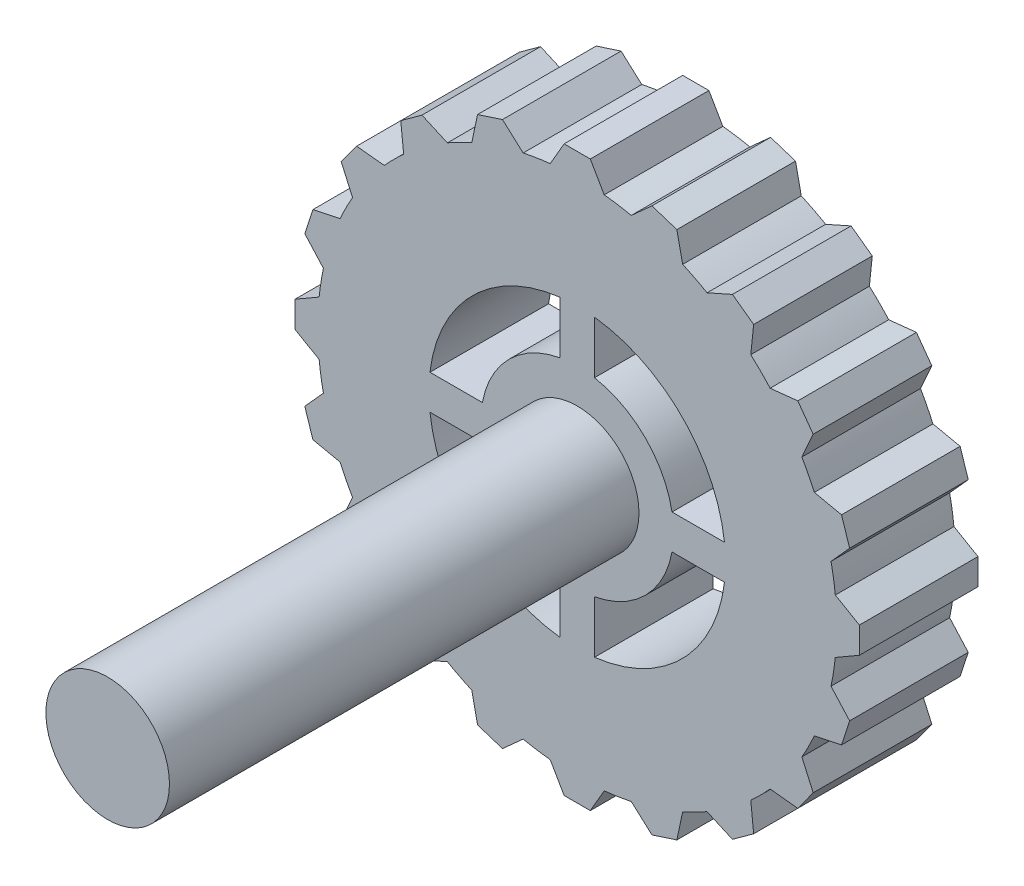
from build123d import *

# Parameters (mm, degrees)
DODANIE_WYCI_GNI_CIE2_DEPTH = 2.4
SZKIC2_R                    = 1.25
DODANIE_WYCI_GNI_CIE3_DEPTH = 2
DODANIE_WYCI_GNI_CIE4_START = 9.5
SZKIC3_R                    = 1.25
DODANIE_WYCI_GNI_CIE4_DEPTH = 9.5
WYTNIJ_WYCI_GNI_CIE1_DEPTH  = 9.5


with BuildPart() as part:
    # Szkic1 → Dodanie-wyciągnięcie2 (new body)
    with BuildSketch(Plane.XY):
        with BuildLine():
            Line((2.133245608, 4.797057762), (2.016205978, 5.347685932))
            Line((2.016205978, 5.347685932), (1.512146024, 5.511464939))
            Line((1.512146024, 5.511464939), (1.093807857, 5.134791561))
            ThreePointArc((1.093807857, 5.134791561), (0.821280941, 5.185363788), (0.546464765, 5.22148219))
            Line((0.546464765, 5.22148219), (0.265, 5.708993464))
            Line((0.265, 5.708993464), (-0.265, 5.708993464))
            Line((-0.265, 5.708993464), (-0.546464765, 5.22148219))
            ThreePointArc((-0.546464765, 5.22148219), (-0.821280941, 5.185363788), (-1.093807857, 5.134791561))
            Line((-1.093807857, 5.134791561), (-1.512146024, 5.511464939))
            Line((-1.512146024, 5.511464939), (-2.016205978, 5.347685932))
            Line((-2.016205978, 5.347685932), (-2.133245608, 4.797057762))
            ThreePointArc((-2.133245608, 4.797057762), (-2.383450124, 4.677784252), (-2.627010944, 4.545471757))
            Line((-2.627010944, 4.545471757), (-3.14127266, 4.774435825))
            Line((-3.14127266, 4.774435825), (-3.570051667, 4.462909641))
            Line((-3.570051667, 4.462909641), (-3.511209508, 3.903063898))
            ThreePointArc((-3.511209508, 3.903063898), (-3.712310601, 3.712310601), (-3.903063898, 3.511209508))
            Line((-3.903063898, 3.511209508), (-4.462909641, 3.570051667))
            Line((-4.462909641, 3.570051667), (-4.774435825, 3.14127266))
            Line((-4.774435825, 3.14127266), (-4.545471757, 2.627010944))
            ThreePointArc((-4.545471757, 2.627010944), (-4.677784252, 2.383450124), (-4.797057762, 2.133245608))
            Line((-4.797057762, 2.133245608), (-5.347685932, 2.016205978))
            Line((-5.347685932, 2.016205978), (-5.511464939, 1.512146024))
            Line((-5.511464939, 1.512146024), (-5.134791561, 1.093807857))
            ThreePointArc((-5.134791561, 1.093807857), (-5.185363788, 0.821280941), (-5.22148219, 0.546464765))
            Line((-5.22148219, 0.546464765), (-5.708993464, 0.265))
            Line((-5.708993464, 0.265), (-5.708993464, -0.265))
            Line((-5.708993464, -0.265), (-5.22148219, -0.546464765))
            ThreePointArc((-5.22148219, -0.546464765), (-5.185363788, -0.821280941), (-5.134791561, -1.093807857))
            Line((-5.134791561, -1.093807857), (-5.511464939, -1.512146024))
            Line((-5.511464939, -1.512146024), (-5.347685932, -2.016205978))
            Line((-5.347685932, -2.016205978), (-4.797057762, -2.133245608))
            ThreePointArc((-4.797057762, -2.133245608), (-4.677784252, -2.383450124), (-4.545471757, -2.627010944))
            Line((-4.545471757, -2.627010944), (-4.774435825, -3.14127266))
            Line((-4.774435825, -3.14127266), (-4.462909641, -3.570051667))
            Line((-4.462909641, -3.570051667), (-3.903063898, -3.511209508))
            ThreePointArc((-3.903063898, -3.511209508), (-3.712310601, -3.712310601), (-3.511209508, -3.903063898))
            Line((-3.511209508, -3.903063898), (-3.570051667, -4.462909641))
            Line((-3.570051667, -4.462909641), (-3.14127266, -4.774435825))
            Line((-3.14127266, -4.774435825), (-2.627010944, -4.545471757))
            ThreePointArc((-2.627010944, -4.545471757), (-2.383450124, -4.677784252), (-2.133245608, -4.797057762))
            Line((-2.133245608, -4.797057762), (-2.016205978, -5.347685932))
            Line((-2.016205978, -5.347685932), (-1.512146024, -5.511464939))
            Line((-1.512146024, -5.511464939), (-1.093807857, -5.134791561))
            ThreePointArc((-1.093807857, -5.134791561), (-0.821280941, -5.185363788), (-0.546464765, -5.22148219))
            Line((-0.546464765, -5.22148219), (-0.265, -5.708993464))
            Line((-0.265, -5.708993464), (0.265, -5.708993464))
            Line((0.265, -5.708993464), (0.546464765, -5.22148219))
            ThreePointArc((0.546464765, -5.22148219), (0.821280941, -5.185363788), (1.093807857, -5.134791561))
            Line((1.093807857, -5.134791561), (1.512146024, -5.511464939))
            Line((1.512146024, -5.511464939), (2.016205978, -5.347685932))
            Line((2.016205978, -5.347685932), (2.133245608, -4.797057762))
            ThreePointArc((2.133245608, -4.797057762), (2.383450124, -4.677784252), (2.627010944, -4.545471757))
            Line((2.627010944, -4.545471757), (3.14127266, -4.774435825))
            Line((3.14127266, -4.774435825), (3.570051667, -4.462909641))
            Line((3.570051667, -4.462909641), (3.511209508, -3.903063898))
            ThreePointArc((3.511209508, -3.903063898), (3.712310601, -3.712310601), (3.903063898, -3.511209508))
            Line((3.903063898, -3.511209508), (4.462909641, -3.570051667))
            Line((4.462909641, -3.570051667), (4.774435825, -3.14127266))
            Line((4.774435825, -3.14127266), (4.545471757, -2.627010944))
            ThreePointArc((4.545471757, -2.627010944), (4.677784252, -2.383450124), (4.797057762, -2.133245608))
            Line((4.797057762, -2.133245608), (5.347685932, -2.016205978))
            Line((5.347685932, -2.016205978), (5.511464939, -1.512146024))
            Line((5.511464939, -1.512146024), (5.134791561, -1.093807857))
            ThreePointArc((5.134791561, -1.093807857), (5.185363788, -0.821280941), (5.22148219, -0.546464765))
            Line((5.22148219, -0.546464765), (5.708993464, -0.265))
            Line((5.708993464, -0.265), (5.708993464, 0.265))
            Line((5.708993464, 0.265), (5.22148219, 0.546464765))
            ThreePointArc((5.22148219, 0.546464765), (5.185363788, 0.821280941), (5.134791561, 1.093807857))
            Line((5.134791561, 1.093807857), (5.511464939, 1.512146024))
            Line((5.511464939, 1.512146024), (5.347685932, 2.016205978))
            Line((5.347685932, 2.016205978), (4.797057762, 2.133245608))
            ThreePointArc((4.797057762, 2.133245608), (4.677784252, 2.383450124), (4.545471757, 2.627010944))
            Line((4.545471757, 2.627010944), (4.774435825, 3.14127266))
            Line((4.774435825, 3.14127266), (4.462909641, 3.570051667))
            Line((4.462909641, 3.570051667), (3.903063898, 3.511209508))
            ThreePointArc((3.903063898, 3.511209508), (3.712310601, 3.712310601), (3.511209508, 3.903063898))
            Line((3.511209508, 3.903063898), (3.570051667, 4.462909641))
            Line((3.570051667, 4.462909641), (3.14127266, 4.774435825))
            Line((3.14127266, 4.774435825), (2.627010944, 4.545471757))
            ThreePointArc((2.627010944, 4.545471757), (2.383450124, 4.677784252), (2.133245608, 4.797057762))
        make_face()
    extrude(amount=DODANIE_WYCI_GNI_CIE2_DEPTH)

    # Szkic2 → Dodanie-wyciągnięcie3 (add)
    with BuildSketch(Plane(origin=(0, 0, 0), x_dir=(-1, 0, 0), z_dir=(0, 0, -1))):
        with Locations(Location((0, 0, 0), (0, 0, 180))):
            Circle(SZKIC2_R)
    extrude(amount=DODANIE_WYCI_GNI_CIE3_DEPTH)

    # Szkic3 → Dodanie-wyciągnięcie4 (add)
    with BuildSketch(Plane.XY.offset(2.4).offset(DODANIE_WYCI_GNI_CIE4_START)):
        Circle(SZKIC3_R)
    extrude(amount=-DODANIE_WYCI_GNI_CIE4_DEPTH)

    # Szkic4 → Wytnij-wyciągnięcie1 (cut)
    with BuildSketch(Plane(origin=(0, 0, 0), x_dir=(-1, 0, 0), z_dir=(0, 0, -1))):
        with BuildLine():
            Line((-2.979513383, 0.35), (-1.918332609, 0.35))
            ThreePointArc((-1.918332609, 0.35), (-1.378858223, 1.378858223), (-0.35, 1.918332609))
            Line((-0.35, 1.918332609), (-0.35, 2.979513383))
            ThreePointArc((-0.35, 2.979513383), (-2.121320344, 2.121320344), (-2.979513383, 0.35))
        make_face()
        with BuildLine():
            Line((-2.979513383, -0.35), (-1.918332609, -0.35))
            ThreePointArc((-1.918332609, -0.35), (-1.378858223, -1.378858223), (-0.35, -1.918332609))
            Line((-0.35, -1.918332609), (-0.35, -2.979513383))
            ThreePointArc((-0.35, -2.979513383), (-2.121320344, -2.121320344), (-2.979513383, -0.35))
        make_face()
        with BuildLine():
            Line((1.918332609, 0.35), (2.979513383, 0.35))
            ThreePointArc((2.979513383, 0.35), (2.121320344, 2.121320344), (0.35, 2.979513383))
            Line((0.35, 2.979513383), (0.35, 1.918332609))
            ThreePointArc((0.35, 1.918332609), (1.378858223, 1.378858223), (1.918332609, 0.35))
        make_face()
        with BuildLine():
            Line((1.918332609, -0.35), (2.979513383, -0.35))
            ThreePointArc((2.979513383, -0.35), (2.121320344, -2.121320344), (0.35, -2.979513383))
            Line((0.35, -2.979513383), (0.35, -1.918332609))
            ThreePointArc((0.35, -1.918332609), (1.378858223, -1.378858223), (1.918332609, -0.35))
        make_face()
    extrude(amount=-WYTNIJ_WYCI_GNI_CIE1_DEPTH, mode=Mode.SUBTRACT)


solid = part.part
